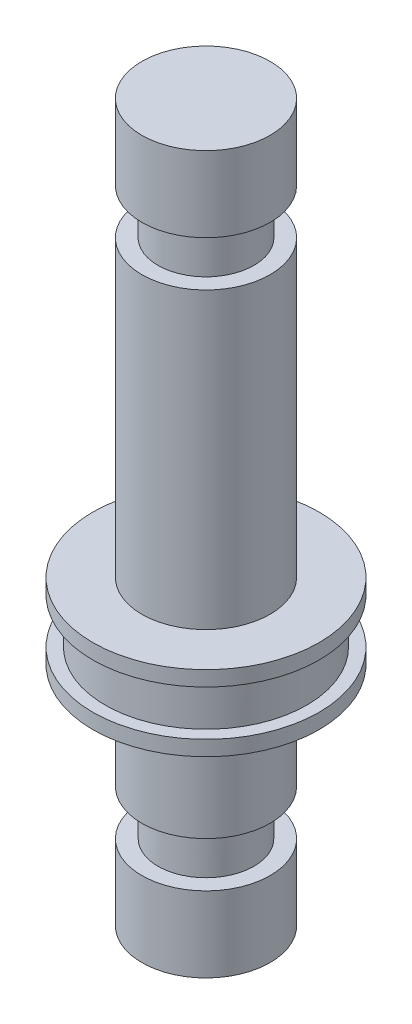
from build123d import *

# Parameters (mm, degrees)
SKETCH1_R                = 13.365
BOSS_EXTRUDE1_DEPTH      = 10
SKETCH2_R                = 15
BOSS_EXTRUDE2_DEPTH      = 2
BOSS_EXTRUDE3_START      = -2
SKETCH3_R                = 15
BOSS_EXTRUDE3_DEPTH      = 2
BOSS_EXTRUDE4_DEPTH      = 30
BOSS_EXTRUDE4_DEPTH_BACK = 65
SKETCH4_R                = 6.365
SKETCH5_R                = 8.5
BOSS_EXTRUDE5_DEPTH      = 10
BOSS_EXTRUDE6_START      = -10
SKETCH6_R                = 8.5
BOSS_EXTRUDE6_DEPTH      = 10
SKETCH7_R                = 8.5
BOSS_EXTRUDE7_DEPTH      = 63


with BuildPart() as part:
    # Sketch1 → Boss-Extrude1 (new body)
    with BuildSketch(Plane(origin=(0, 0, 0), x_dir=(1, 0, 0), z_dir=(0, 1, 0))):
        with Locations(Location((0, 0, 0), (0, 0, 270))):
            Circle(SKETCH1_R)
    extrude(amount=BOSS_EXTRUDE1_DEPTH)

    # Sketch2 → Boss-Extrude2 (add)
    with BuildSketch(Plane(origin=(0, 10, 0), x_dir=(1, 0, 0), z_dir=(0, 1, 0))):
        with Locations(Location((0, 0, 0), (0, 0, 270))):
            Circle(SKETCH2_R)
    extrude(amount=-BOSS_EXTRUDE2_DEPTH)

    # Sketch3 → Boss-Extrude3 (add)
    with BuildSketch(Plane.XZ.offset(BOSS_EXTRUDE3_START)):
        with Locations(Location((0, 0, 0), (0, 0, 90))):
            Circle(SKETCH3_R)
    extrude(amount=BOSS_EXTRUDE3_DEPTH)

    # Sketch4 → Boss-Extrude4 (add, two sides: drawn at the far end of the back side and taken through both)
    with BuildSketch(Plane.XZ.offset(-BOSS_EXTRUDE4_DEPTH_BACK)):
        with Locations(Location((0, 0, 0), (0, 0, 270))):
            Circle(SKETCH4_R)
    extrude(amount=BOSS_EXTRUDE4_DEPTH + BOSS_EXTRUDE4_DEPTH_BACK)

    # Sketch5 → Boss-Extrude5 (add)
    with BuildSketch(Plane.XZ.offset(30)):
        with Locations(Location((0, 0, 0), (0, 0, 270))):
            Circle(SKETCH5_R)
    extrude(amount=-BOSS_EXTRUDE5_DEPTH)

    # Sketch6 → Boss-Extrude6 (add)
    with BuildSketch(Plane(origin=(0, 65, 0), x_dir=(1, 0, 0), z_dir=(0, 1, 0)).offset(BOSS_EXTRUDE6_START)):
        with Locations(Location((0, 0, 0), (0, 0, 90))):
            Circle(SKETCH6_R)
    extrude(amount=BOSS_EXTRUDE6_DEPTH)

    # Sketch7 → Boss-Extrude7 (add)
    with BuildSketch(Plane(origin=(0, -14, 0), x_dir=(1, 0, 0), z_dir=(0, 1, 0))):
        with Locations(Location((0, 0, 0), (0, 0, 270))):
            Circle(SKETCH7_R)
    extrude(amount=BOSS_EXTRUDE7_DEPTH)


solid = part.part
